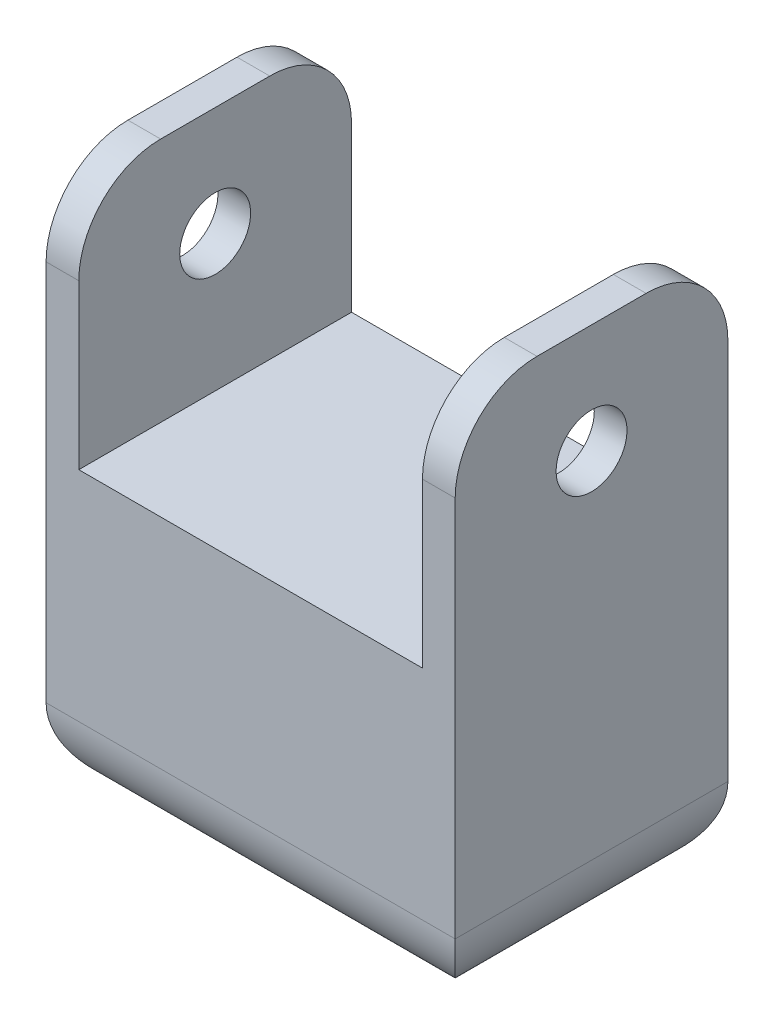
from build123d import *

# Parameters (mm, degrees)
SKETCH1_W           = 38.1
SKETCH1_H           = 25.4
BOSS_EXTRUDE1_DEPTH = 25.4
SKETCH2_W           = 32.004
SKETCH2_H           = 25.4
CUT_EXTRUDE1_DEPTH  = 22.86
SKETCH3_R           = 3.302
CUT_EXTRUDE2_DEPTH  = 48.519048812
FILLET1_R           = 7.62
SKETCH4_W           = 38.1
SKETCH4_H           = 25.4
BOSS_EXTRUDE2_DEPTH = 25.4
FILLET2_R           = 7.62


with BuildPart() as part:
    # Sketch1 → Boss-Extrude1 (new body)
    with BuildSketch(Plane(origin=(0, 0, 0), x_dir=(1, 0, 0), z_dir=(0, 1, 0))):
        Rectangle(SKETCH1_W, SKETCH1_H)
    extrude(amount=BOSS_EXTRUDE1_DEPTH)

    # Sketch2 → Cut-Extrude1 (cut)
    with BuildSketch(Plane(origin=(0, 25.4, 0), x_dir=(1, 0, 0), z_dir=(0, 1, 0))):
        Rectangle(SKETCH2_W, SKETCH2_H)
    extrude(amount=-CUT_EXTRUDE1_DEPTH, mode=Mode.SUBTRACT)

    # Sketch3 → Cut-Extrude2 (cut, through all)
    with BuildSketch(Plane.ZY.offset(19.05)):
        with Locations((0, 15.24)):
            Circle(SKETCH3_R)
    extrude(amount=-CUT_EXTRUDE2_DEPTH, mode=Mode.SUBTRACT)

    # Fillet1
    fillet1_edges = [part.edges().sort_by_distance(p)[0] for p in [
        (-17.526, 25.4, -12.7),
        (17.526, 25.4, 12.7),
        (-17.526, 25.4, 12.7),
        (17.526, 25.4, -12.7),
    ]]
    fillet(fillet1_edges, radius=FILLET1_R)

    # Sketch4 → Boss-Extrude2 (add)
    with BuildSketch(Plane.XZ):
        Rectangle(SKETCH4_W, SKETCH4_H)
    extrude(amount=BOSS_EXTRUDE2_DEPTH)

    # Fillet2
    fillet2_edges = [part.edges().sort_by_distance(p)[0] for p in [
        (-19.05, -25.4, 0),
        (0, -25.4, -12.7),
        (19.05, -25.4, 0),
        (0, -25.4, 12.7),
    ]]
    fillet(fillet2_edges, radius=FILLET2_R)


solid = part.part
